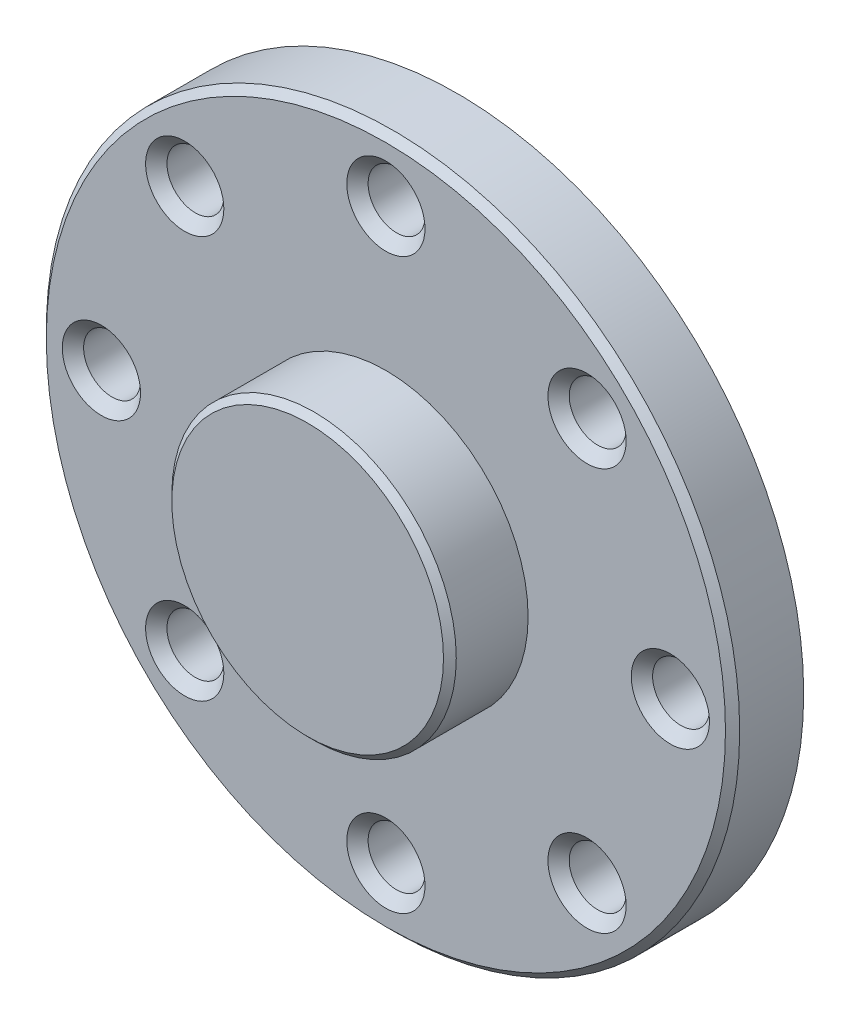
from build123d import *

# Parameters (mm, degrees)
SKETCH1_R                    = 9.75
BOSS_EXTRUDE1_DEPTH          = 2
SKETCH2_R                    = 4
BOSS_EXTRUDE2_DEPTH          = 2.2
CHAMFER5_SIZE                = 0.2
CHAMFER6_SIZE                = 0.18
SKETCH8_R                    = 0.8
CUT_EXTRUDE1_DEPTH           = 14.962986787
CHAMFER7_SIZE                = 0.3
CIRPATTERN4_COUNT            = 8
CHAMFER7_OF_CIRPATTERN4_SIZE = 0.3


with BuildPart() as part:
    # Sketch1 → Boss-Extrude1 (new body)
    with BuildSketch(Plane.XY):
        Circle(SKETCH1_R)
    extrude(amount=BOSS_EXTRUDE1_DEPTH)

    # Sketch2 → Boss-Extrude2 (add)
    with BuildSketch(Plane.XY.offset(2)):
        Circle(SKETCH2_R)
    extrude(amount=BOSS_EXTRUDE2_DEPTH)

    # Chamfer5
    chamfer5_edges = [part.edges().sort_by_distance(p)[0] for p in [
        (-9.75, 0, 2),
    ]]
    chamfer(chamfer5_edges, length=CHAMFER5_SIZE)

    # Chamfer6
    chamfer6_edges = [part.edges().sort_by_distance(p)[0] for p in [
        (-4, 0, 4.2),
    ]]
    chamfer(chamfer6_edges, length=CHAMFER6_SIZE)

    # Sketch8 → Cut-Extrude1 (cut, through all)
    with BuildSketch(Plane.XY.offset(2)):
        with Locations((0, 8)):
            Circle(SKETCH8_R)
    cut_extrude1 = extrude(amount=-CUT_EXTRUDE1_DEPTH, mode=Mode.SUBTRACT)

    # Chamfer7
    chamfer7_edges = [part.edges().sort_by_distance(p)[0] for p in [
        (-0.8, 8, 2),
    ]]
    chamfer(chamfer7_edges, length=CHAMFER7_SIZE)

    # CirPattern4: Cut-Extrude1 ×8 about axis
    cirpattern4_axis = Axis((0, 0, 0), (0, 0, 1))
    for i in range(1, CIRPATTERN4_COUNT):
        add(cut_extrude1.rotate(cirpattern4_axis, i * 360 / CIRPATTERN4_COUNT), mode=Mode.SUBTRACT)

    # Chamfer7 of CirPattern4
    chamfer7_of_cirpattern4_edges = [part.edges().sort_by_distance(p)[0] for p in [
        (-6.222539674, 5.091168825, 2),
        (-8, -0.8, 2),
        (-5.091168825, -6.222539674, 2),
        (0.8, -8, 2),
        (6.222539674, -5.091168825, 2),
        (8, 0.8, 2),
        (5.091168825, 6.222539674, 2),
    ]]
    chamfer(chamfer7_of_cirpattern4_edges, length=CHAMFER7_OF_CIRPATTERN4_SIZE)


solid = part.part
